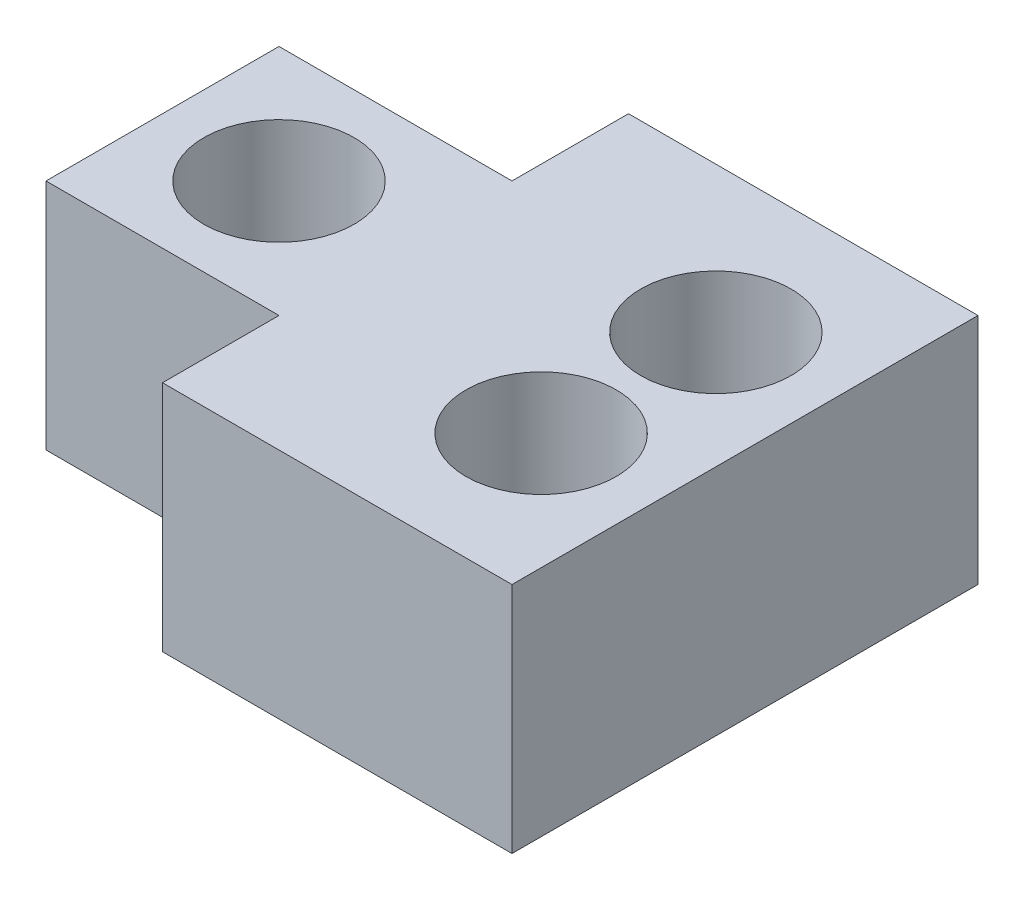
from build123d import *

# Parameters (mm, degrees)
SKETCH1_R           = 6.45
SKETCH1_W           = 20
SKETCH1_H           = 20
BOSS_EXTRUDE1_DEPTH = 20


with BuildPart() as part:
    # Sketch1 → Boss-Extrude1 (new body)
    # profile 1 of 2: a face of its own
    with BuildSketch(Plane(origin=(0, 0, 0), x_dir=(1, 0, 0), z_dir=(0, 1, 0))):
        Polygon((-13.056470244, 18.913583857), (-13.056470244, 8.913583857), (-13.056470244, -11.086416143), (-13.056470244, -21.086416143), (16.943529756, -21.086416143), (16.943529756, 18.913583857), align=None)
        with Locations(Location((6.943529756, -8.586416143, 0), (0, 0, 270))):
            Circle(SKETCH1_R, mode=Mode.SUBTRACT)
        with Locations(Location((6.943529756, 6.413583857, 0), (0, 0, 270))):
            Circle(SKETCH1_R, mode=Mode.SUBTRACT)
    # profile 2 of 2: a face of its own
    with BuildSketch(Plane(origin=(0, 0, 0), x_dir=(1, 0, 0), z_dir=(0, 1, 0))):
        with Locations((-23.056470244, -1.086416143)):
            Rectangle(SKETCH1_W, SKETCH1_H)
        with Locations(Location((-23.056470244, -1.086416143, 0), (0, 0, 270))):
            Circle(SKETCH1_R, mode=Mode.SUBTRACT)
    extrude(amount=BOSS_EXTRUDE1_DEPTH)


solid = part.part
